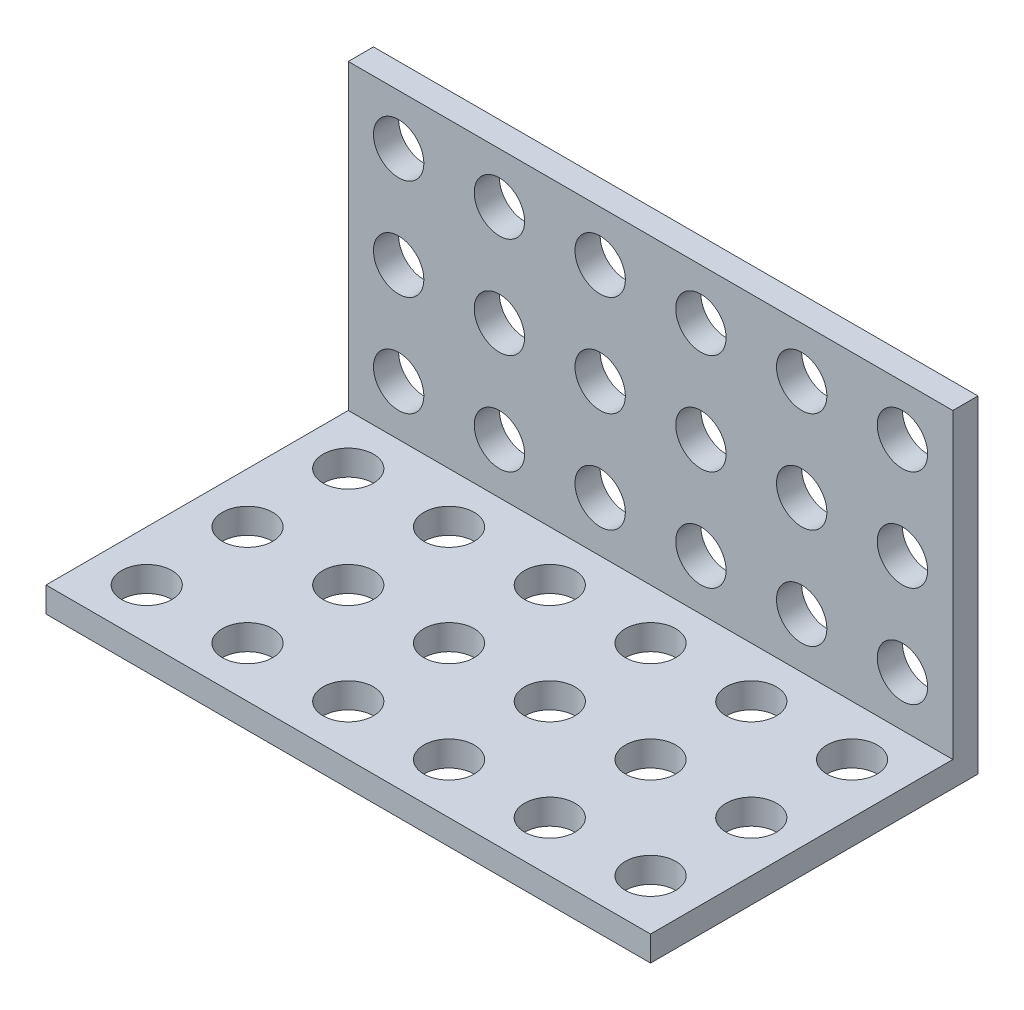
from build123d import *

# Parameters (mm, degrees)
EXTRUDE_1_DEPTH     = 48
SKETCH_2_R          = 2
CUT_EXTRUDE_1_DEPTH = 48
SKETCH_3_R          = 2
CUT_EXTRUDE_3_DEPTH = 48


with BuildPart() as part:
    # 草图1 → 凸台-拉伸1 (new body)
    with BuildSketch(Plane(origin=(0, 0, 0), x_dir=(0, 0, -1), z_dir=(1, 0, 0))):
        Polygon((0, 0), (-26, 0), (-26, 2), (-2, 2), (-2, 26), (0, 26), align=None)
    extrude(amount=EXTRUDE_1_DEPTH)

    # 草图2 → 切除-拉伸1 (cut)
    with BuildSketch(Plane.XY.offset(2)):
        with Locations((4, 22)):
            Circle(SKETCH_2_R)
        with Locations((4, 14)):
            Circle(SKETCH_2_R)
        with Locations((4, 6)):
            Circle(SKETCH_2_R)
        with Locations((12, 22)):
            Circle(SKETCH_2_R)
        with Locations((12, 14)):
            Circle(SKETCH_2_R)
        with Locations((12, 6)):
            Circle(SKETCH_2_R)
        with Locations((20, 22)):
            Circle(SKETCH_2_R)
        with Locations((20, 14)):
            Circle(SKETCH_2_R)
        with Locations((20, 6)):
            Circle(SKETCH_2_R)
        with Locations((28, 22)):
            Circle(SKETCH_2_R)
        with Locations((28, 14)):
            Circle(SKETCH_2_R)
        with Locations((28, 6)):
            Circle(SKETCH_2_R)
        with Locations((36, 22)):
            Circle(SKETCH_2_R)
        with Locations((36, 14)):
            Circle(SKETCH_2_R)
        with Locations((36, 6)):
            Circle(SKETCH_2_R)
        with Locations((44, 22)):
            Circle(SKETCH_2_R)
        with Locations((44, 14)):
            Circle(SKETCH_2_R)
        with Locations((44, 6)):
            Circle(SKETCH_2_R)
    extrude(amount=-CUT_EXTRUDE_1_DEPTH, mode=Mode.SUBTRACT)

    # 草图3 → 切除-拉伸3 (cut)
    with BuildSketch(Plane(origin=(0, 2, 0), x_dir=(1, 0, 0), z_dir=(0, 1, 0))):
        with Locations(Location((4, -22, 0), (0, 0, 270))):
            Circle(SKETCH_3_R)
        with Locations(Location((4, -14, 0), (0, 0, 270))):
            Circle(SKETCH_3_R)
        with Locations(Location((4, -6, 0), (0, 0, 270))):
            Circle(SKETCH_3_R)
        with Locations(Location((12, -6, 0), (0, 0, 270))):
            Circle(SKETCH_3_R)
        with Locations(Location((12, -14, 0), (0, 0, 270))):
            Circle(SKETCH_3_R)
        with Locations(Location((12, -22, 0), (0, 0, 270))):
            Circle(SKETCH_3_R)
        with Locations(Location((20, -6, 0), (0, 0, 270))):
            Circle(SKETCH_3_R)
        with Locations(Location((20, -14, 0), (0, 0, 270))):
            Circle(SKETCH_3_R)
        with Locations(Location((20, -22, 0), (0, 0, 270))):
            Circle(SKETCH_3_R)
        with Locations(Location((28, -6, 0), (0, 0, 270))):
            Circle(SKETCH_3_R)
        with Locations(Location((28, -14, 0), (0, 0, 270))):
            Circle(SKETCH_3_R)
        with Locations(Location((28, -22, 0), (0, 0, 270))):
            Circle(SKETCH_3_R)
        with Locations(Location((36, -6, 0), (0, 0, 270))):
            Circle(SKETCH_3_R)
        with Locations(Location((36, -14, 0), (0, 0, 270))):
            Circle(SKETCH_3_R)
        with Locations(Location((36, -22, 0), (0, 0, 270))):
            Circle(SKETCH_3_R)
        with Locations(Location((44, -6, 0), (0, 0, 270))):
            Circle(SKETCH_3_R)
        with Locations(Location((44, -14, 0), (0, 0, 270))):
            Circle(SKETCH_3_R)
        with Locations(Location((44, -22, 0), (0, 0, 270))):
            Circle(SKETCH_3_R)
    extrude(amount=-CUT_EXTRUDE_3_DEPTH, mode=Mode.SUBTRACT)


solid = part.part
